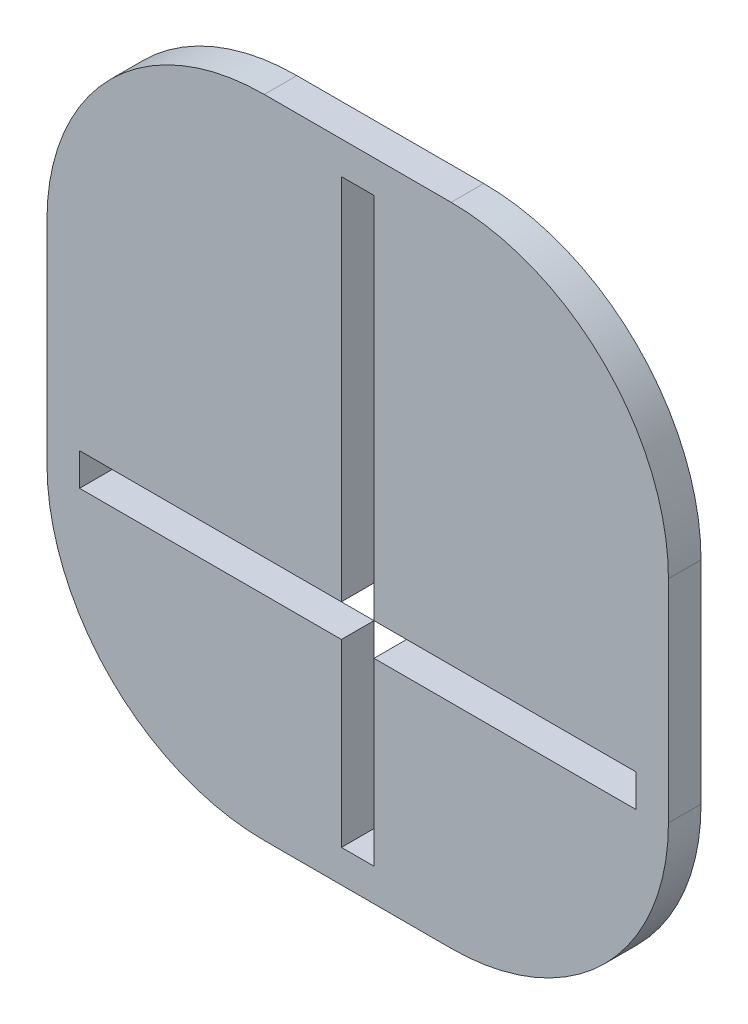
from build123d import *

# Parameters (mm, degrees)
SALIENTE_EXTRUIR1_DEPTH = 3


with BuildPart() as part:
    # Croquis1 → Saliente-Extruir1 (new body)
    with BuildSketch(Plane.XY):
        with BuildLine():
            Line((-8.6, -29.735), (8.6, -29.735))
            ThreePointArc((8.6, -29.735), (22.742135624, -23.877135624), (28.6, -9.735))
            Line((28.6, -9.735), (28.6, 9.735))
            ThreePointArc((28.6, 9.735), (22.742135624, 23.877135624), (8.6, 29.735))
            Line((8.6, 29.735), (-8.6, 29.735))
            ThreePointArc((-8.6, 29.735), (-22.742135624, 23.877135624), (-28.6, 9.735))
            Line((-28.6, 9.735), (-28.6, -9.735))
            ThreePointArc((-28.6, -9.735), (-22.742135624, -23.877135624), (-8.6, -29.735))
        make_face()
        Polygon((-25.6, -10.16), (-25.6, -7.16), (-1.5, -7.16), (-1.5, 26.735), (1.5, 26.735), (1.5, -7.16), (25.6, -7.16), (25.6, -10.16), (1.5, -10.16), (1.5, -26.735), (-1.5, -26.735), (-1.5, -10.16), align=None, mode=Mode.SUBTRACT)
    extrude(amount=SALIENTE_EXTRUIR1_DEPTH)


solid = part.part
